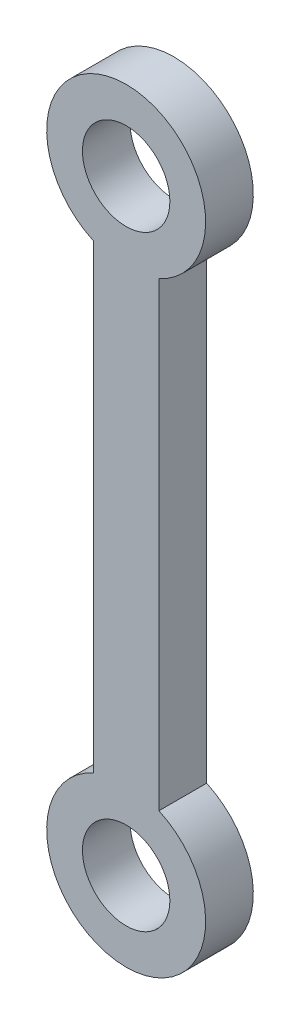
from build123d import *

# Parameters (mm, degrees)
SKETCH3_R           = 2.75
BOSS_EXTRUDE3_DEPTH = 1.5


with BuildPart() as part:
    # Sketch3 → Boss-Extrude3 (new, symmetric)
    with BuildSketch(Plane.XY):
        with BuildLine():
            Line((644.749881263, -1262.591629214), (644.749881263, -1291.581848105))
            ThreePointArc((644.749881263, -1291.581848105), (642.687607751, -1301.136738659), (640.625334239, -1291.581848105))
            Line((640.625334239, -1291.581848105), (640.625334239, -1262.591629214))
            ThreePointArc((640.625334239, -1262.591629214), (642.687607751, -1253.036738659), (644.749881263, -1262.591629214))
        make_face()
        with Locations((642.687607751, -1296.136738659)):
            Circle(SKETCH3_R, mode=Mode.SUBTRACT)
        with Locations((642.687607751, -1258.036738659)):
            Circle(SKETCH3_R, mode=Mode.SUBTRACT)
    extrude(amount=BOSS_EXTRUDE3_DEPTH, both=True)


solid = part.part
